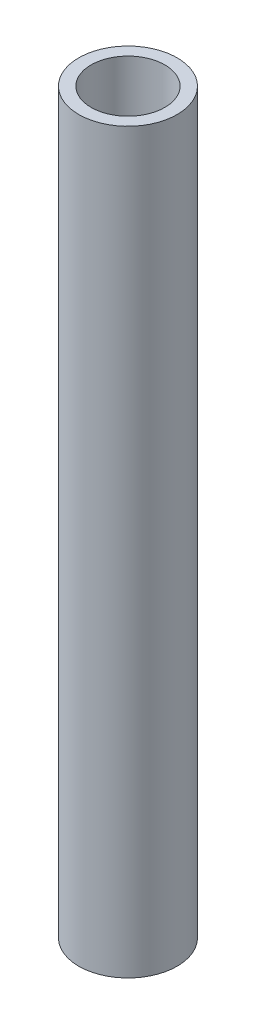
from build123d import *

# Parameters (mm, degrees)
SKETCH_1_R      = 4
SKETCH_1_R_2    = 3
EXTRUDE_1_DEPTH = 60


with BuildPart() as part:
    # 草图1 → 凸台-拉伸1 (new body)
    with BuildSketch(Plane(origin=(0, 0, 0), x_dir=(1, 0, 0), z_dir=(0, 1, 0))):
        with Locations(Location((0, 0, 0), (0, 0, 270))):
            Circle(SKETCH_1_R)
        with Locations(Location((0, 0, 0), (0, 0, 270))):
            Circle(SKETCH_1_R_2, mode=Mode.SUBTRACT)
    extrude(amount=EXTRUDE_1_DEPTH)


solid = part.part
